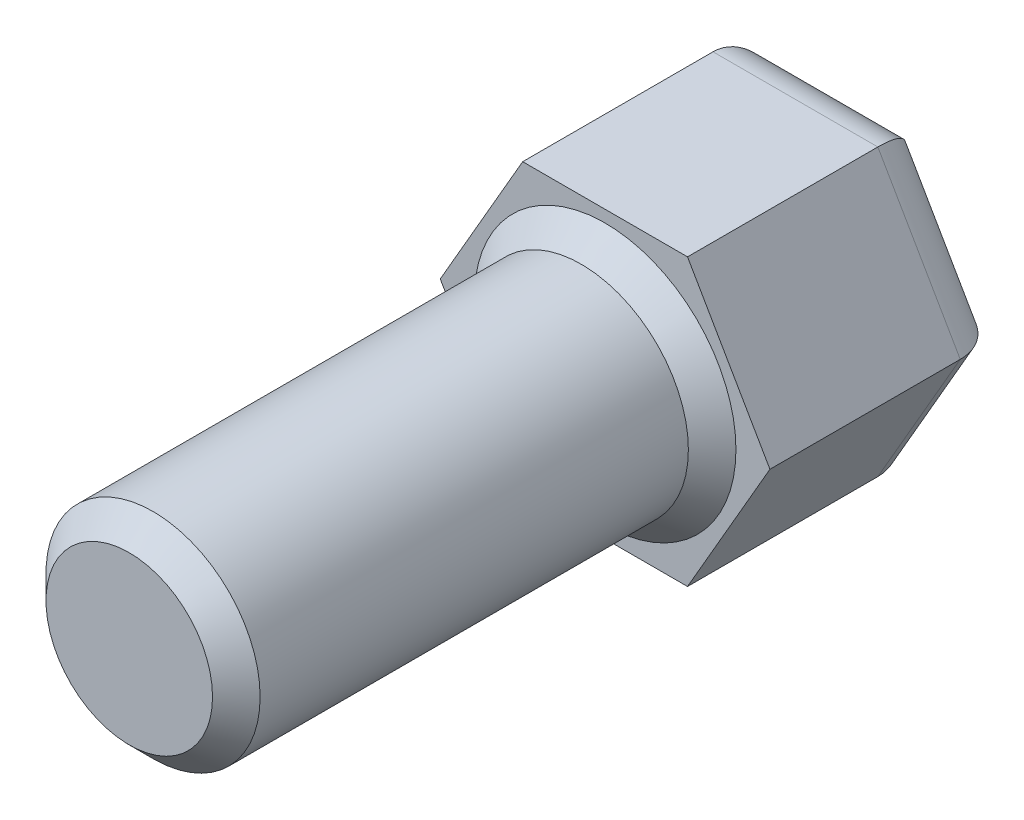
from build123d import *

# Parameters (mm, degrees)
BOSS_EXTRUDE1_DEPTH = 15
SKETCH2_R           = 4.5
CUT_EXTRUDE1_DEPTH  = 20
FILLET1_R           = 2
CHAMFER1_SIZE       = 1


with BuildPart() as part:
    # Sketch1 → Boss-Extrude1 (new, symmetric)
    with BuildSketch(Plane(origin=(0, 0, 0), x_dir=(0, 1, 0), z_dir=(0, 0, 1))):
        Polygon((0, -6.92820323), (6, -3.464101615), (6, 3.464101615), (0, 6.92820323), (-6, 3.464101615), (-6, -3.464101615), align=None)
    extrude(amount=BOSS_EXTRUDE1_DEPTH, both=True)

    # Sketch2 → Cut-Extrude1 (cut)
    with BuildSketch(Plane.XY.offset(15)):
        Polygon((-3.464101615, -6), (3.464101615, -6), (6.92820323, 0), (3.464101615, 6), (-3.464101615, 6), (-6.92820323, 0), align=None)
        Circle(SKETCH2_R, mode=Mode.SUBTRACT)
    extrude(amount=-CUT_EXTRUDE1_DEPTH, mode=Mode.SUBTRACT)

    # Fillet1
    fillet1_edges = [part.edges().sort_by_distance(p)[0] for p in [
        (0, -6, -15),
        (-5.196152423, -3, -15),
        (-5.196152423, 3, -15),
        (0, 6, -15),
        (5.196152423, 3, -15),
        (5.196152423, -3, -15),
    ]]
    fillet(fillet1_edges, radius=FILLET1_R)

    # Chamfer1
    chamfer1_edges = [part.edges().sort_by_distance(p)[0] for p in [
        (-4.5, 0, 15),
        (-4.5, 0, -5),
    ]]
    chamfer(chamfer1_edges, length=CHAMFER1_SIZE)


solid = part.part
